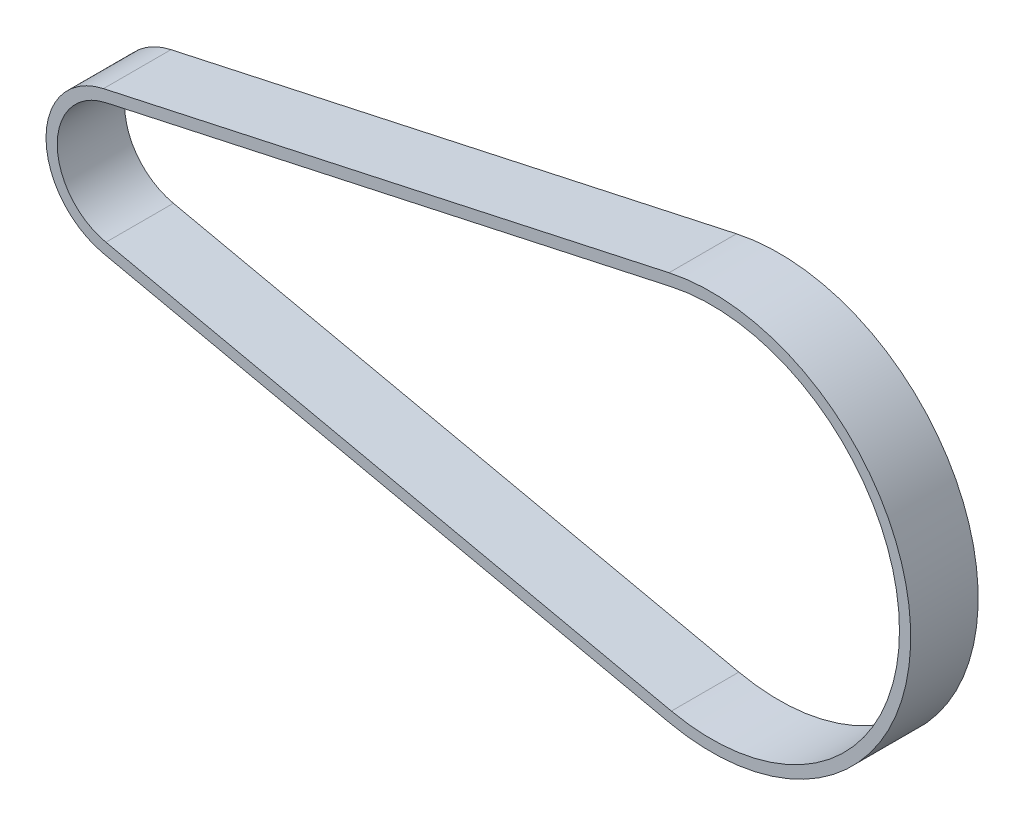
from build123d import *

# Parameters (mm, degrees)
SALIENTE_EXTRUIR1_DEPTH = 6


with BuildPart() as part:
    # Croquis1 → Saliente-Extruir1 (new body)
    with BuildSketch(Plane.XY):
        with BuildLine():
            Line((-1.384527765, 6.350833242), (48.900564309, 17.313348469))
            ThreePointArc((48.900564309, 17.313348469), (70.395, 0), (48.900564309, -17.313348469))
            Line((48.900564309, -17.313348469), (-1.384527765, -6.350833242))
            ThreePointArc((-1.384527765, -6.350833242), (-6.5, 0), (-1.384527765, 6.350833242))
        make_face()
        with BuildLine():
            Line((-1.171523493, 5.373781974), (49.113568581, 16.336297201))
            ThreePointArc((49.113568581, 16.336297201), (69.395, 0), (49.113568581, -16.336297201))
            Line((49.113568581, -16.336297201), (-1.171523493, -5.373781974))
            ThreePointArc((-1.171523493, -5.373781974), (-5.5, 0), (-1.171523493, 5.373781974))
        make_face(mode=Mode.SUBTRACT)
    extrude(amount=SALIENTE_EXTRUIR1_DEPTH)


solid = part.part
